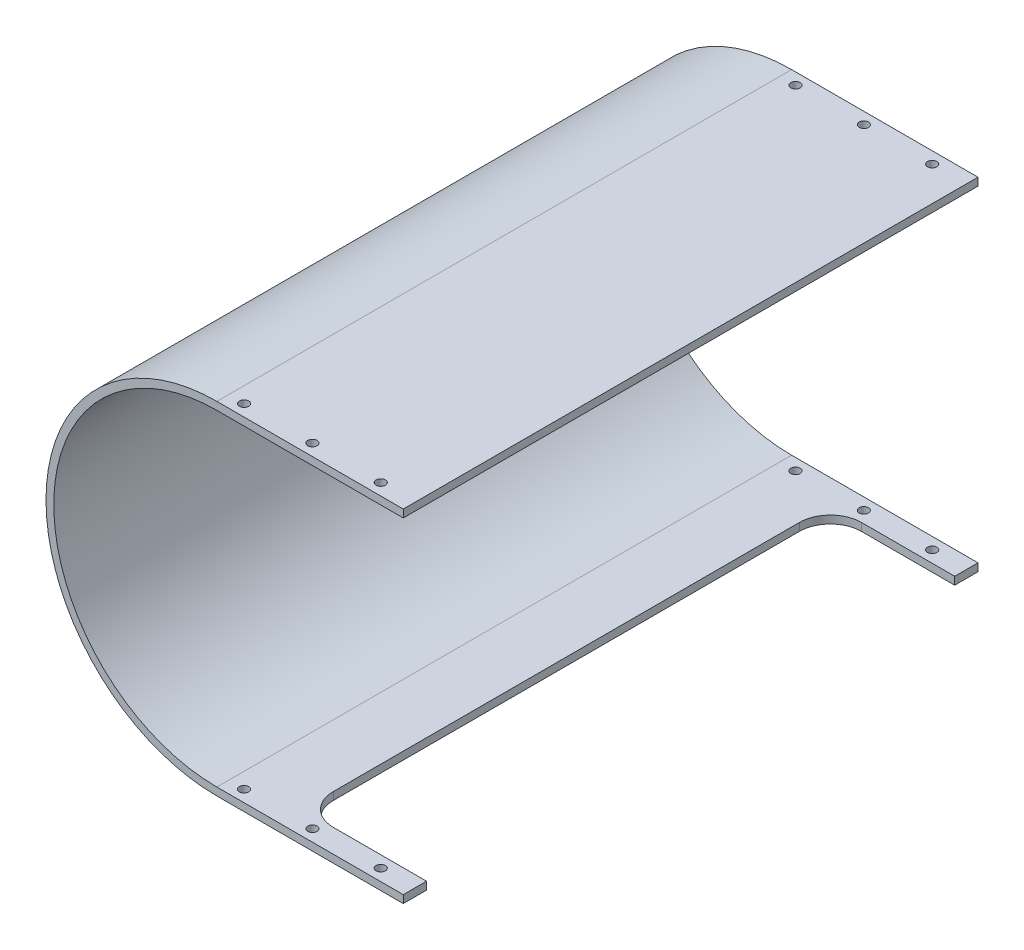
from build123d import *

# Parameters (mm, degrees)
BOSS_EXTRUDE1_DEPTH     = 92.5
SKETCH2_W               = 80
SKETCH2_H               = 170
CUT_EXTRUDE1_DEPTH      = 2.5
FILLET1_R               = 10
CUT_EXTRUDE2_DEPTH      = 158.5
CUT_EXTRUDE2_DEPTH_BACK = 158.5
SKETCH3_R               = 1.5


with BuildPart() as part:
    # Sketch1 → Boss-Extrude1 (new, symmetric)
    with BuildSketch(Plane.XY):
        with BuildLine():
            Line((-60, 55), (0, 55))
            Line((0, 55), (0, 52.5))
            Line((0, 52.5), (-60, 52.5))
            ThreePointArc((-60, 52.5), (-112.5, 0), (-60, -52.5))
            Line((-60, -52.5), (0, -52.5))
            Line((0, -52.5), (0, -55))
            Line((0, -55), (-60, -55))
            ThreePointArc((-60, -55), (-115, 0), (-60, 55))
        make_face()
    extrude(amount=BOSS_EXTRUDE1_DEPTH, both=True)

    # Sketch2 → Cut-Extrude1 (cut)
    with BuildSketch(Plane.XZ.offset(55)):
        Rectangle(SKETCH2_W, SKETCH2_H)
    extrude(amount=-CUT_EXTRUDE1_DEPTH, mode=Mode.SUBTRACT)

    # Fillet1
    fillet1_edges = [part.edges().sort_by_distance(p)[0] for p in [
        (-40, -53.75, 85),
        (-40, -53.75, -85),
    ]]
    fillet(fillet1_edges, radius=FILLET1_R)

    # Sketch3 → Cut-Extrude2 (cut, two sides: drawn at the far end of the back side and taken through both)
    with BuildSketch(Plane(origin=(0, 0, 0), x_dir=(1, 0, 0), z_dir=(0, 1, 0)).offset(-CUT_EXTRUDE2_DEPTH_BACK)):
        with Locations(Location((-55, 88.75, 0), (0, 0, 270))):
            Circle(SKETCH3_R)
        with Locations(Location((-33, 88.75, 0), (0, 0, 270))):
            Circle(SKETCH3_R)
        with Locations(Location((-11, 88.75, 0), (0, 0, 270))):
            Circle(SKETCH3_R)
        with Locations(Location((-11, -88.75, 0), (0, 0, 270))):
            Circle(SKETCH3_R)
        with Locations(Location((-33, -88.75, 0), (0, 0, 270))):
            Circle(SKETCH3_R)
        with Locations(Location((-55, -88.75, 0), (0, 0, 270))):
            Circle(SKETCH3_R)
    extrude(amount=CUT_EXTRUDE2_DEPTH + CUT_EXTRUDE2_DEPTH_BACK, mode=Mode.SUBTRACT)


solid = part.part
